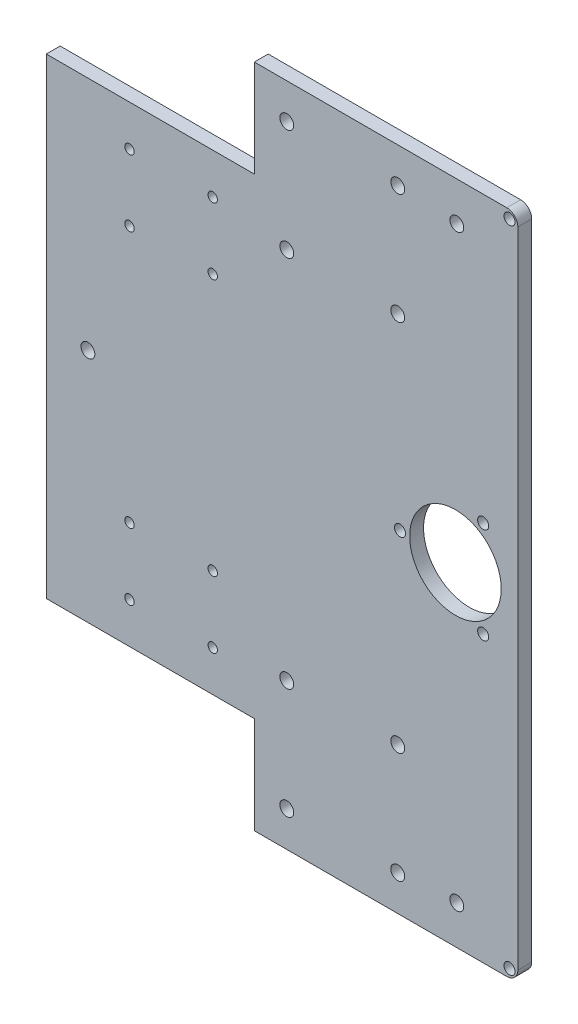
from build123d import *

# Parameters (mm, degrees)
SKETCH1_W           = 170
SKETCH1_H           = 240
BOSS_EXTRUDE1_DEPTH = 5
SKETCH2_R           = 16.5
CUT_EXTRUDE1_DEPTH  = 148.139389696
SKETCH3_R           = 2
CUT_EXTRUDE2_DEPTH  = 148.139389696
SKETCH4_R           = 1.7
CUT_EXTRUDE3_DEPTH  = 148.139389696
SKETCH5_W           = 75
SKETCH5_H           = 35
CUT_EXTRUDE4_DEPTH  = 148.139389696
FILLET1_R           = 4
SKETCH6_R           = 2
CUT_EXTRUDE5_DEPTH  = 148.139389696
FILLET2_R           = 4
SKETCH7_R           = 2.5
CUT_EXTRUDE6_DEPTH  = 148.139389696
SKETCH8_R           = 2.5
CUT_EXTRUDE7_DEPTH  = 148.139389696


with BuildPart() as part:
    # Sketch1 → Boss-Extrude1 (new body)
    with BuildSketch(Plane.XY):
        Rectangle(SKETCH1_W, SKETCH1_H)
    extrude(amount=BOSS_EXTRUDE1_DEPTH)

    # Sketch2 → Cut-Extrude1 (cut, through all)
    with BuildSketch(Plane.XY.offset(5)):
        with Locations((62.5, 0)):
            Circle(SKETCH2_R)
    extrude(amount=-CUT_EXTRUDE1_DEPTH, mode=Mode.SUBTRACT)

    # Sketch3 → Cut-Extrude2 (cut, through all)
    with BuildSketch(Plane.XY.offset(5)):
        with Locations((72.5, -17.320508076)):
            Circle(SKETCH3_R)
        with Locations((72.5, 17.320508076)):
            Circle(SKETCH3_R)
        with Locations((42.5, 0)):
            Circle(SKETCH3_R)
    extrude(amount=-CUT_EXTRUDE2_DEPTH, mode=Mode.SUBTRACT)

    # Sketch4 → Cut-Extrude3 (cut, through all)
    with BuildSketch(Plane.XY.offset(5)):
        with Locations((-25, 46.3125)):
            Circle(SKETCH4_R)
        with Locations((-25, 70.3125)):
            Circle(SKETCH4_R)
        with Locations((-55, 46.3125)):
            Circle(SKETCH4_R)
        with Locations((-55, 70.3125)):
            Circle(SKETCH4_R)
        with Locations(Location((-55, -70.3125, 0), (0, 0, 180))):
            Circle(SKETCH4_R)
        with Locations(Location((-25, -70.3125, 0), (0, 0, 180))):
            Circle(SKETCH4_R)
        with Locations(Location((-55, -46.3125, 0), (0, 0, 180))):
            Circle(SKETCH4_R)
        with Locations(Location((-25, -46.3125, 0), (0, 0, 180))):
            Circle(SKETCH4_R)
    extrude(amount=-CUT_EXTRUDE3_DEPTH, mode=Mode.SUBTRACT)

    # Sketch5 → Cut-Extrude4 (cut, through all)
    with BuildSketch(Plane.XY.offset(5)):
        with Locations((-47.5, 102.5)):
            Rectangle(SKETCH5_W, SKETCH5_H)
        with Locations((-47.5, -102.5)):
            Rectangle(SKETCH5_W, SKETCH5_H)
    extrude(amount=-CUT_EXTRUDE4_DEPTH, mode=Mode.SUBTRACT)

    # Fillet1
    fillet1_edges = [part.edges().sort_by_distance(p)[0] for p in [
        (85, -120, 2.5),
    ]]
    fillet(fillet1_edges, radius=FILLET1_R)

    # Sketch6 → Cut-Extrude5 (cut, through all)
    with BuildSketch(Plane.XY.offset(5)):
        with Locations((82, -117)):
            Circle(SKETCH6_R)
    cut_extrude5 = extrude(amount=-CUT_EXTRUDE5_DEPTH, mode=Mode.SUBTRACT)

    # Mirror5: Cut-Extrude5 across plane
    add(cut_extrude5.mirror(Plane.ZX), mode=Mode.SUBTRACT)

    # Fillet2
    fillet2_edges = [part.edges().sort_by_distance(p)[0] for p in [
        (85, 120, 2.5),
    ]]
    fillet(fillet2_edges, radius=FILLET2_R)

    # Sketch7 → Cut-Extrude6 (cut, through all)
    with BuildSketch(Plane.XY.offset(5)):
        with Locations((41.7, 107.25)):
            Circle(SKETCH7_R)
        with Locations((41.7, 67.25)):
            Circle(SKETCH7_R)
        with Locations((1.7, 67.25)):
            Circle(SKETCH7_R)
        with Locations((1.7, 107.25)):
            Circle(SKETCH7_R)
        with Locations((41.7, -107.25)):
            Circle(SKETCH7_R)
        with Locations((1.7, -107.25)):
            Circle(SKETCH7_R)
        with Locations((1.7, -67.25)):
            Circle(SKETCH7_R)
        with Locations((41.7, -67.25)):
            Circle(SKETCH7_R)
    extrude(amount=-CUT_EXTRUDE6_DEPTH, mode=Mode.SUBTRACT)

    # Sketch8 → Cut-Extrude7 (cut, through all)
    with BuildSketch(Plane(origin=(0, 0, 0), x_dir=(-1, 0, 0), z_dir=(0, 0, -1))):
        with Locations((-63, 106)):
            Circle(SKETCH8_R)
        with Locations((-63, -106)):
            Circle(SKETCH8_R)
        with Locations((70, 0)):
            Circle(SKETCH8_R)
    extrude(amount=-CUT_EXTRUDE7_DEPTH, mode=Mode.SUBTRACT)


solid = part.part
